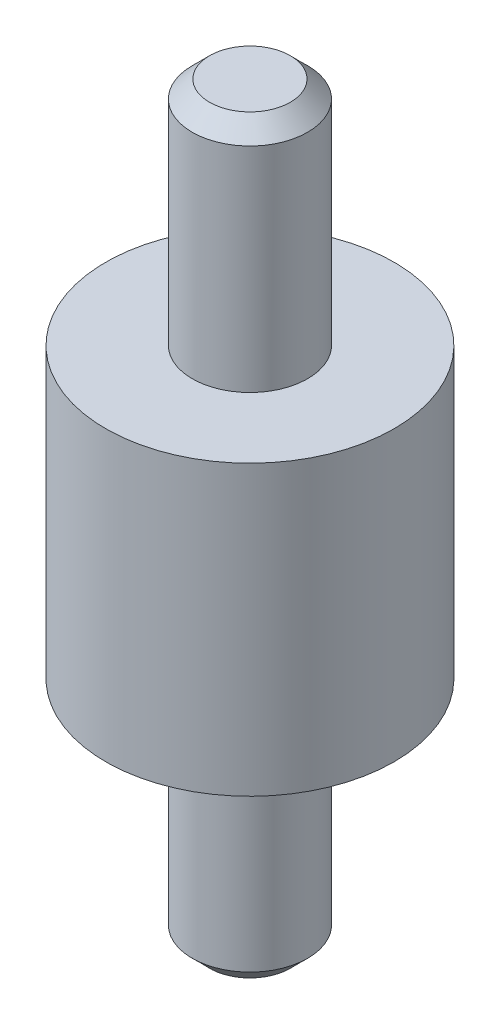
from build123d import *

# Parameters (mm, degrees)
SKETCH1_W             = 3.175
SKETCH1_H             = 12.7
CHAMFER1_SIZE         = 0.9525
BODY_MOVE_COPY1_ANGLE = 180
SKETCH4_W             = 7.9375
SKETCH4_H             = 15.875


with BuildPart() as part:
    # Sketch1 → Revolve1 (revolve)
    with BuildSketch(Plane.XY):
        with Locations((1.5875, 14.2875)):
            Rectangle(SKETCH1_W, SKETCH1_H)
    revolve(axis=Axis((0, 7.9375, 0), (0, 1, 0)))

    # Chamfer1
    chamfer1_edges = [part.edges().sort_by_distance(p)[0] for p in [
        (-3.175, 20.6375, 0),
    ]]
    chamfer(chamfer1_edges, length=CHAMFER1_SIZE)


with BuildPart() as body_2:
    # Body-Move/Copy1: copy of part
    add(part.part.rotate(Axis((0, 0, 0), (1, 0, 0)), BODY_MOVE_COPY1_ANGLE))


with BuildPart() as part_1:
    add(part.part)

    add(body_2.part)  # Revolve2 merges body 2
    # Sketch4 → Revolve2 (revolve)
    with BuildSketch(Plane.XY):
        with Locations((3.96875, 0)):
            Rectangle(SKETCH4_W, SKETCH4_H)
    revolve(axis=Axis((0, -7.9375, 0), (0, 1, 0)))


solid = part_1.part
